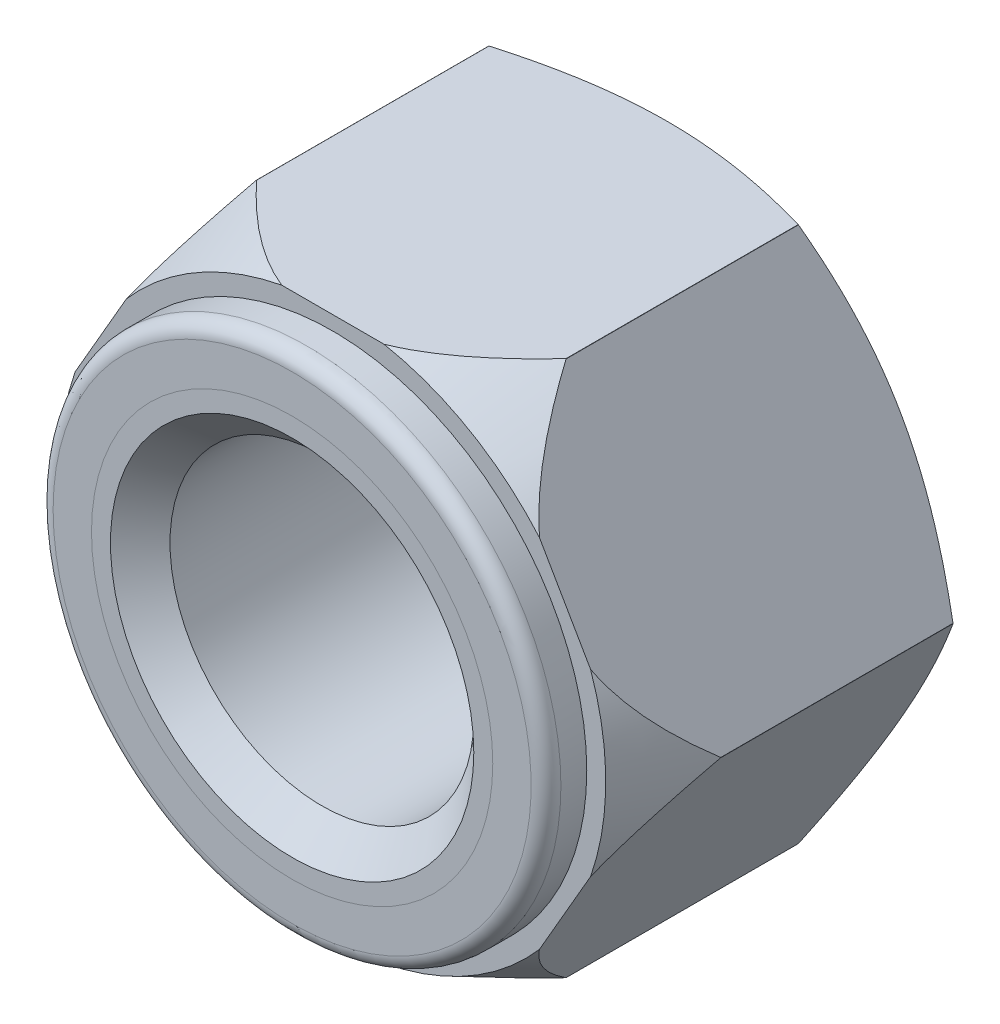
from build123d import *

# Parameters (mm, degrees)
CUT_EXTRUDE1_START = -12.602516
SKETCH2_OUTSIDE_W  = 29.232
SKETCH2_OUTSIDE_H  = 29.232
CUT_EXTRUDE1_DEPTH = 11.234893
FILLET1_R          = 0.5


with BuildPart() as part:
    # Sketch1 → Revolve1 (revolve)
    with BuildSketch(Plane(origin=(0, 0, 0), x_dir=(0, 0, -1), z_dir=(1, 0, 0)), mode=Mode.PRIVATE) as revolve1_sk:
        Polygon((13.3, 7.791923789), (13.3, 6.1), (12.3, 5.1), (1, 5.1), (0, 6.1), (0, 8.524769367), (1.367623399, 8.524769367), (1.367623399, 9.162502632), (4, 10.39), (11.8, 10.39), align=None)
    revolve(revolve1_sk.sketch.rotate(Axis((0, 0, 0), (0, 0, -1)), 90), axis=Axis((0, 0, 0), (0, 0, -1)))

    # Sketch2 outside → Cut-Extrude1 (cut)
    with BuildSketch(Plane.XY.offset(CUT_EXTRUDE1_START)):
        Rectangle(SKETCH2_OUTSIDE_W, SKETCH2_OUTSIDE_H)
        Polygon((10.392304845, 0), (5.196152423, 9), (-5.196152423, 9), (-10.392304845, 0), (-5.196152423, -9), (5.196152423, -9), align=None, mode=Mode.SUBTRACT)
    extrude(amount=CUT_EXTRUDE1_DEPTH, mode=Mode.SUBTRACT)

    # Fillet1
    fillet1_edges = [part.edges().sort_by_distance(p)[0] for p in [
        (-8.524769367, 0, 0),
    ]]
    fillet(fillet1_edges, radius=FILLET1_R)


solid = part.part
